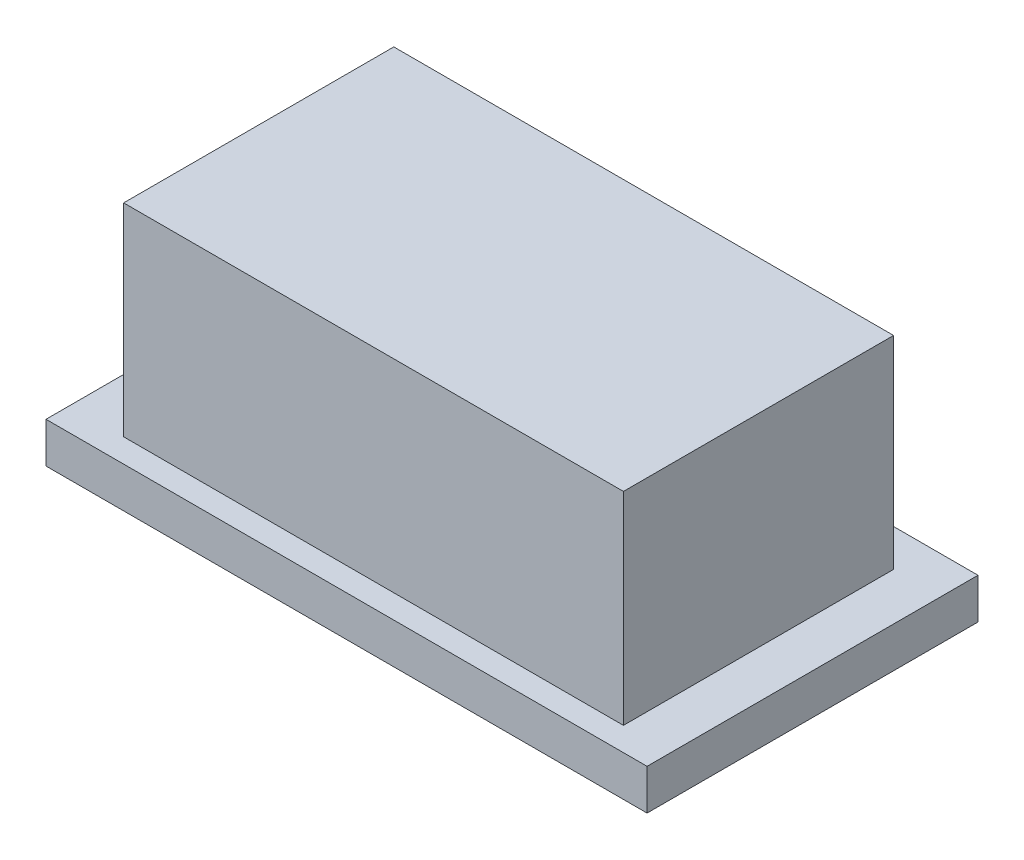
from build123d import *

# Parameters (mm, degrees)
SKETCH_1_W      = 17.8
SKETCH_1_H      = 9.8
EXTRUDE_1_DEPTH = 1.2
SKETCH_2_W      = 14.8
SKETCH_2_H      = 8
EXTRUDE_2_DEPTH = 6


with BuildPart() as part:
    # 草图1 → 凸台-拉伸1 (new body)
    with BuildSketch(Plane(origin=(0, 0, 0), x_dir=(1, 0, 0), z_dir=(0, 1, 0))):
        with Locations((-8.9, 4.9)):
            Rectangle(SKETCH_1_W, SKETCH_1_H)
    extrude(amount=EXTRUDE_1_DEPTH)

    # 草图2 → 凸台-拉伸2 (add)
    with BuildSketch(Plane(origin=(0, 1.2, 0), x_dir=(1, 0, 0), z_dir=(0, 1, 0))):
        with Locations((-8.8, 4.7)):
            Rectangle(SKETCH_2_W, SKETCH_2_H)
    extrude(amount=EXTRUDE_2_DEPTH)


solid = part.part
